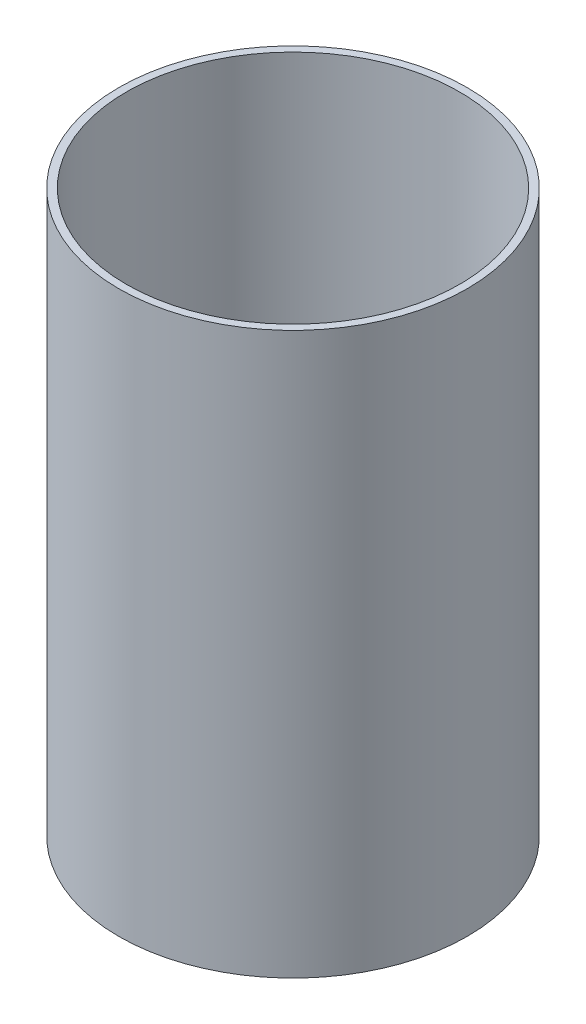
from build123d import *

# Parameters (mm, degrees)
ESQUISSE1_W = 3.5
ESQUISSE1_H = 260


with BuildPart() as part:
    # Esquisse1 → Révolution1 (revolve)
    with BuildSketch(Plane.XY, mode=Mode.PRIVATE) as r_volution1_sk:
        with Locations((79, 35.876108374)):
            Rectangle(ESQUISSE1_W, ESQUISSE1_H)
    revolve(r_volution1_sk.sketch.rotate(Axis((0, 86.32454844, 0), (0, -1, 0)), 90), axis=Axis((0, 86.32454844, 0), (0, -1, 0)))


solid = part.part
